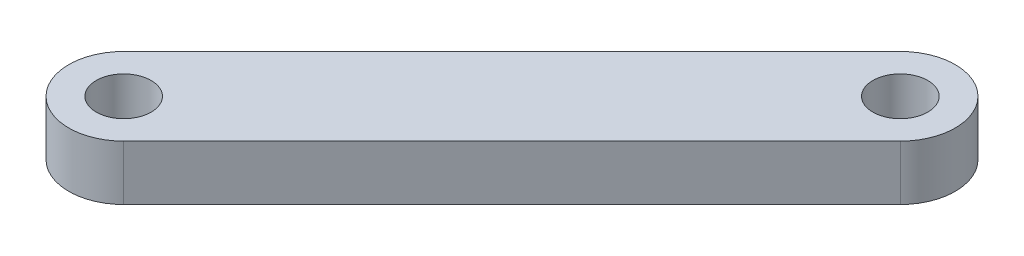
from build123d import *

# Parameters (mm, degrees)
SKETCH1_R           = 5
BOSS_EXTRUDE1_DEPTH = 10


with BuildPart() as part:
    # Sketch1 → Boss-Extrude1 (new body)
    with BuildSketch(Plane(origin=(0, 0, 0), x_dir=(1, 0, 0), z_dir=(0, 1, 0))):
        with BuildLine():
            Line((-7.071067812, 7.071067812), (63.639610307, 77.781745931))
            ThreePointArc((63.639610307, 77.781745931), (77.781745931, 77.781745931), (77.781745931, 63.639610307))
            Line((77.781745931, 63.639610307), (7.071067812, -7.071067812))
            ThreePointArc((7.071067812, -7.071067812), (-7.071067812, -7.071067812), (-7.071067812, 7.071067812))
        make_face()
        with Locations(Location((0, 0, 0), (0, 0, 270))):
            Circle(SKETCH1_R, mode=Mode.SUBTRACT)
        with Locations(Location((70.710678119, 70.710678119, 0), (0, 0, 270))):
            Circle(SKETCH1_R, mode=Mode.SUBTRACT)
    extrude(amount=BOSS_EXTRUDE1_DEPTH)


solid = part.part
